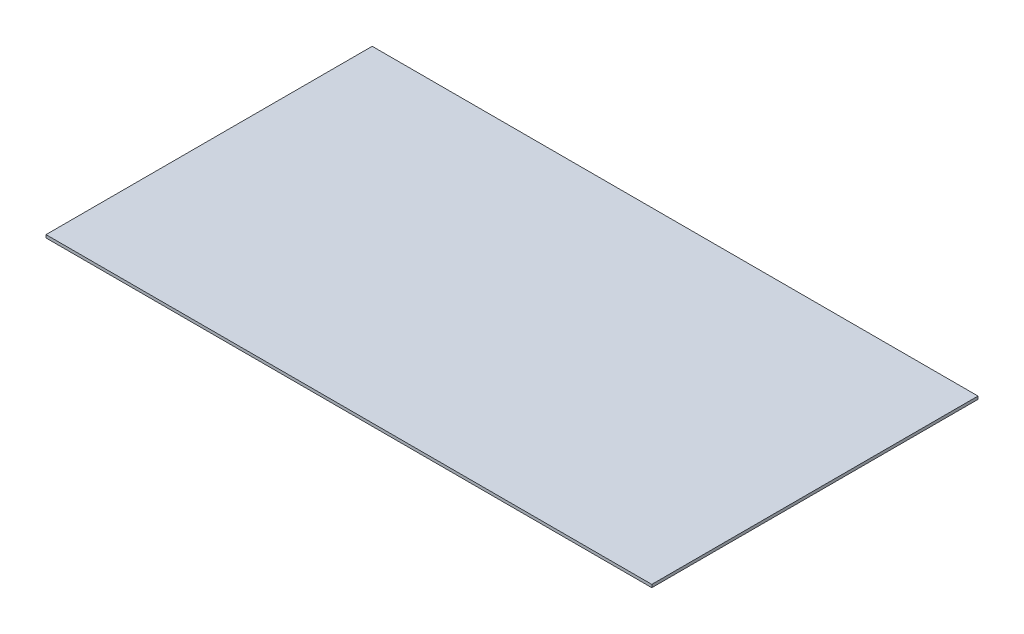
from build123d import *

# Parameters (mm, degrees)
SKETCH1_W           = 660.4
SKETCH1_H           = 355.6
BOSS_EXTRUDE1_DEPTH = 3.175


with BuildPart() as part:
    # Sketch1 → Boss-Extrude1 (new body)
    with BuildSketch(Plane(origin=(0, 0, 0), x_dir=(1, 0, 0), z_dir=(0, 1, 0))):
        with Locations((330.2, 177.8)):
            Rectangle(SKETCH1_W, SKETCH1_H)
    extrude(amount=BOSS_EXTRUDE1_DEPTH)


solid = part.part
